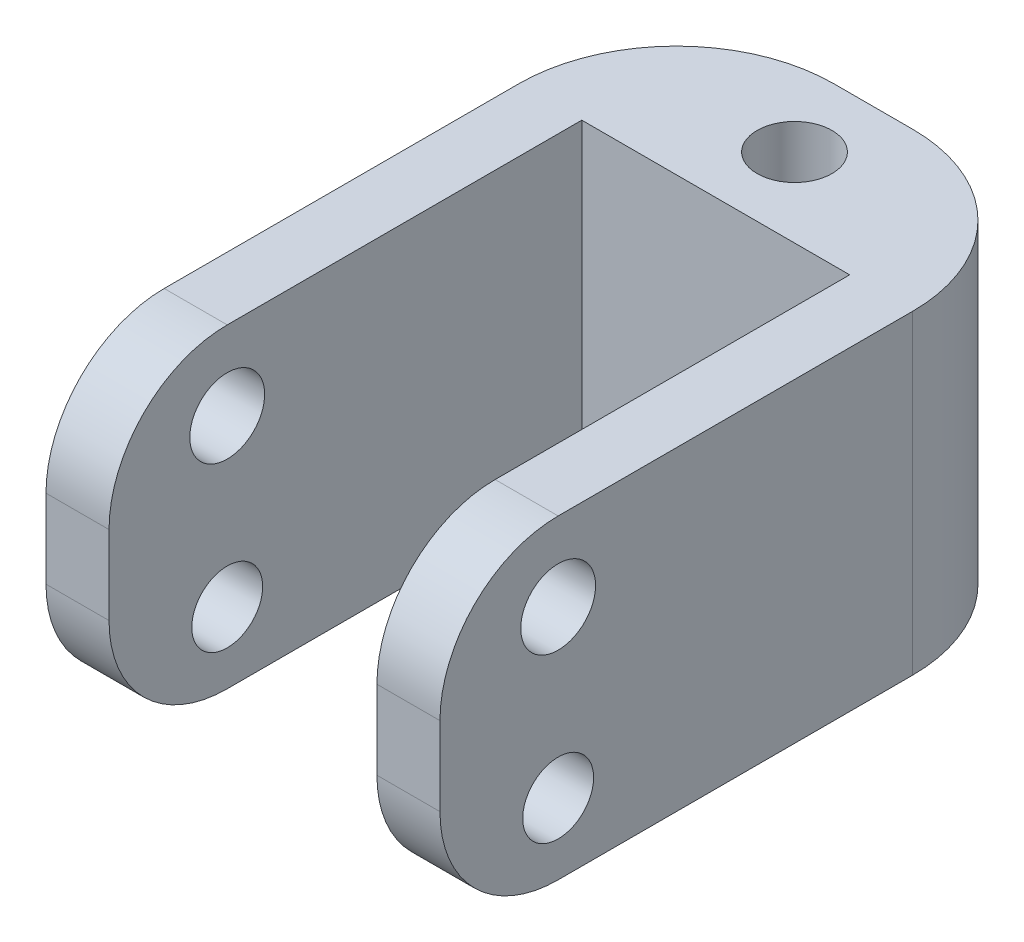
from build123d import *

# Parameters (mm, degrees)
SKETCH4_W               = 80
SKETCH4_H               = 40
SKETCH4_R               = 4.75
SKETCH4_R_2             = 4.5
BOSS_EXTRUDE2_DEPTH     = 25
CUT_EXTRUDE3_DEPTH      = 52.23475383
CUT_EXTRUDE3_DEPTH_BACK = 52.23475383
SKETCH5_W               = 34
SKETCH5_H               = 60
CUT_EXTRUDE4_DEPTH      = 52.23475383
CUT_EXTRUDE4_DEPTH_BACK = 52.23475383
SKETCH6_R               = 4.75
FILLET1_R               = 20
FILLET3_R               = 15


with BuildPart() as part:
    # Sketch4 → Boss-Extrude2 (new, symmetric)
    with BuildSketch(Plane(origin=(0, 0, 0), x_dir=(0, 0, -1), z_dir=(1, 0, 0))):
        Rectangle(SKETCH4_W, SKETCH4_H)
        with Locations((-25, 10)):
            Circle(SKETCH4_R, mode=Mode.SUBTRACT)
        with Locations((-25, -11)):
            Circle(SKETCH4_R_2, mode=Mode.SUBTRACT)
    extrude(amount=BOSS_EXTRUDE2_DEPTH, both=True)

    # Sketch5 → Cut-Extrude3 (cut, two sides: drawn at the far end of the back side and taken through both)
    with BuildSketch(Plane(origin=(0, 0, 0), x_dir=(1, 0, 0), z_dir=(0, 1, 0)).offset(-CUT_EXTRUDE3_DEPTH_BACK)):
        with Locations((0, -10)):
            Rectangle(SKETCH5_W, SKETCH5_H)
    extrude(amount=CUT_EXTRUDE3_DEPTH + CUT_EXTRUDE3_DEPTH_BACK, mode=Mode.SUBTRACT)

    # Sketch6 → Cut-Extrude4 (cut, two sides: drawn at the far end of the back side and taken through both)
    with BuildSketch(Plane(origin=(0, 0, 0), x_dir=(1, 0, 0), z_dir=(0, 1, 0)).offset(-CUT_EXTRUDE4_DEPTH_BACK)):
        with Locations(Location((0, 30, 0), (0, 0, 270))):
            Circle(SKETCH6_R)
    extrude(amount=CUT_EXTRUDE4_DEPTH + CUT_EXTRUDE4_DEPTH_BACK, mode=Mode.SUBTRACT)

    # Fillet1
    fillet1_edges = [part.edges().sort_by_distance(p)[0] for p in [
        (25, 0, -40),
        (-25, 0, -40),
    ]]
    fillet(fillet1_edges, radius=FILLET1_R)

    # Fillet3
    fillet3_edges = [part.edges().sort_by_distance(p)[0] for p in [
        (-21, -20, 40),
        (-21, 20, 40),
        (21, -20, 40),
        (21, 20, 40),
    ]]
    fillet(fillet3_edges, radius=FILLET3_R)


solid = part.part
